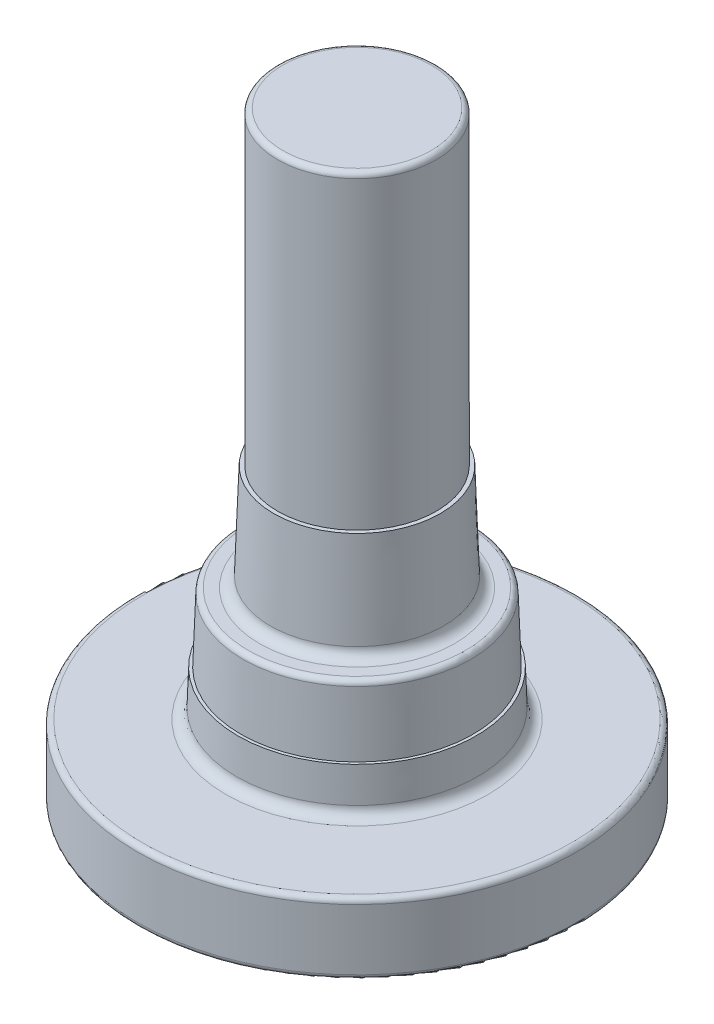
from build123d import *

# Parameters (mm, degrees)
FILETE1_R             = 2
FILETE2_R             = 2
FILETE3_R             = 1
FILETE4_R             = 1
ESBO_O2_W             = 15
ESBO_O2_H             = 28
CORTE_EXTRUS_O1_DEPTH = 7
FILETE6_R             = 0.5


with BuildPart() as part:
    # Esboço1 → Revolução1 (revolve)
    with BuildSketch(Plane.XY, mode=Mode.PRIVATE) as revolu_o1_sk:
        Polygon((0, -34.786716792), (20, -34.786716792), (20.122222693, -38.286716792), (41.5, -38.286716792), (41.5, -24.786716792), (22.796826541, -24.786716792), (22.5, -16.286716792), (21.953970003, -16.286716792), (21.5, -3.286716792), (16.44841539, -3.286716792), (15.75, 16.713283208), (15, 16.713283208), (15, 75.213283208), (0, 75.213283208), align=None)
    revolve(revolu_o1_sk.sketch.rotate(Axis((0, 75.213283208, 0), (0, -1, 0)), 90), axis=Axis((0, 75.213283208, 0), (0, -1, 0)))

    # Filete1
    filete1_edges = [part.edges().sort_by_distance(p)[0] for p in [
        (0, -24.786716792, -22.796826541),
    ]]
    fillet(filete1_edges, radius=FILETE1_R)

    # Filete2
    filete2_edges = [part.edges().sort_by_distance(p)[0] for p in [
        (0, -3.286716792, -16.44841539),
    ]]
    fillet(filete2_edges, radius=FILETE2_R)

    # Filete3
    filete3_edges = [part.edges().sort_by_distance(p)[0] for p in [
        (0, -3.286716792, -21.5),
        (0, -24.786716792, -41.5),
        (0, -38.286716792, -41.5),
        (0, 75.213283208, -15),
    ]]
    fillet(filete3_edges, radius=FILETE3_R)

    # Filete4
    filete4_edges = [part.edges().sort_by_distance(p)[0] for p in [
        (0, -38.286716792, -20.122222693),
        (0, -34.786716792, -20),
    ]]
    fillet(filete4_edges, radius=FILETE4_R)

    # Esboço2 → Corte-extrusão1 (cut)
    with BuildSketch(Plane.XZ.offset(34.786716792)):
        with Locations((0, -1.5)):
            Rectangle(ESBO_O2_W, ESBO_O2_H)
    extrude(amount=-CORTE_EXTRUS_O1_DEPTH, mode=Mode.SUBTRACT)

    # Filete6
    filete6_edges = [part.edges().sort_by_distance(p)[0] for p in [
        (7.5, -27.786716792, -1.5),
        (7.5, -31.286716792, 12.5),
        (0, -27.786716792, -15.5),
        (7.5, -31.286716792, -15.5),
        (-7.5, -27.786716792, -1.5),
        (-7.5, -31.286716792, -15.5),
        (0, -27.786716792, 12.5),
        (-7.5, -31.286716792, 12.5),
        (7.5, -34.786716792, -1.5),
        (0, -34.786716792, 12.5),
        (-7.5, -34.786716792, -1.5),
        (0, -34.786716792, -15.5),
    ]]
    fillet(filete6_edges, radius=FILETE6_R)


solid = part.part
